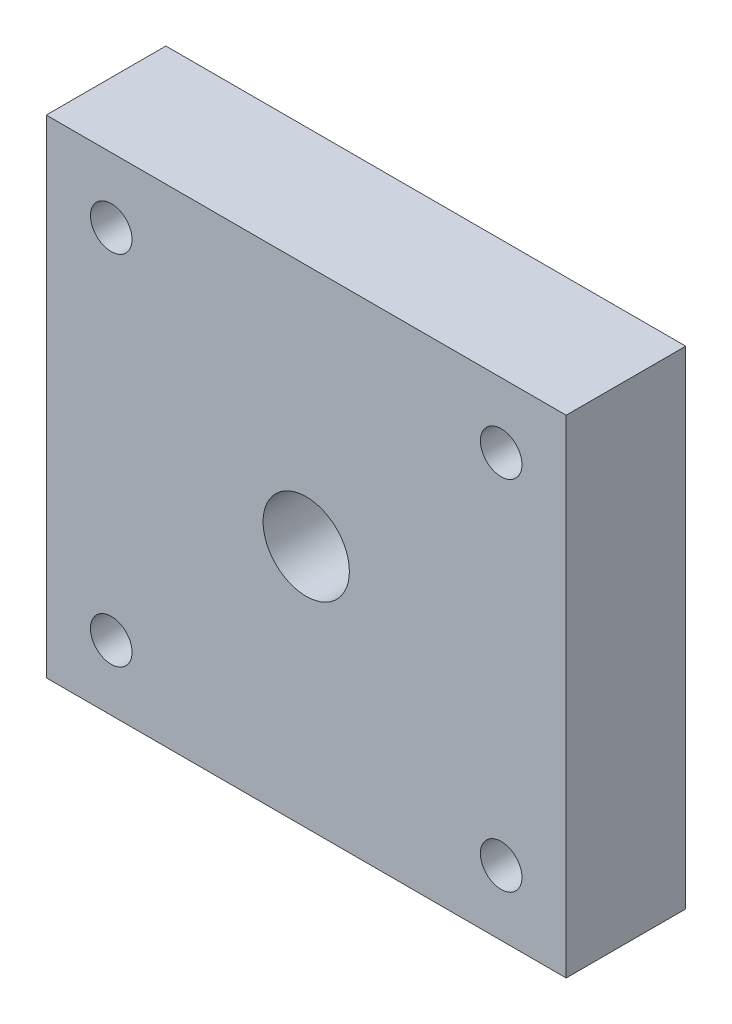
from build123d import *

# Parameters (mm, degrees)
SKETCH1_W           = 50.8
SKETCH1_H           = 47.625
BOSS_EXTRUDE1_DEPTH = 11.684
SKETCH2_R           = 4.2164
CUT_EXTRUDE1_DEPTH  = 71.60663199
SKETCH3_R           = 2.032
CUT_EXTRUDE2_DEPTH  = 71.60663199


with BuildPart() as part:
    # Sketch1 → Boss-Extrude1 (new body)
    with BuildSketch(Plane.XY):
        with Locations((25.4, 23.8125)):
            Rectangle(SKETCH1_W, SKETCH1_H)
    extrude(amount=BOSS_EXTRUDE1_DEPTH)

    # Sketch2 → Cut-Extrude1 (cut, through all)
    with BuildSketch(Plane.XY.offset(11.684)):
        with Locations((25.4, 23.8125)):
            Circle(SKETCH2_R)
    extrude(amount=-CUT_EXTRUDE1_DEPTH, mode=Mode.SUBTRACT)

    # Sketch3 → Cut-Extrude2 (cut, through all)
    with BuildSketch(Plane.XY.offset(11.684)):
        with Locations((6.35, 41.275)):
            Circle(SKETCH3_R)
        with Locations((44.45, 41.275)):
            Circle(SKETCH3_R)
        with Locations((44.45, 6.35)):
            Circle(SKETCH3_R)
        with Locations((6.35, 6.35)):
            Circle(SKETCH3_R)
    extrude(amount=-CUT_EXTRUDE2_DEPTH, mode=Mode.SUBTRACT)


solid = part.part
